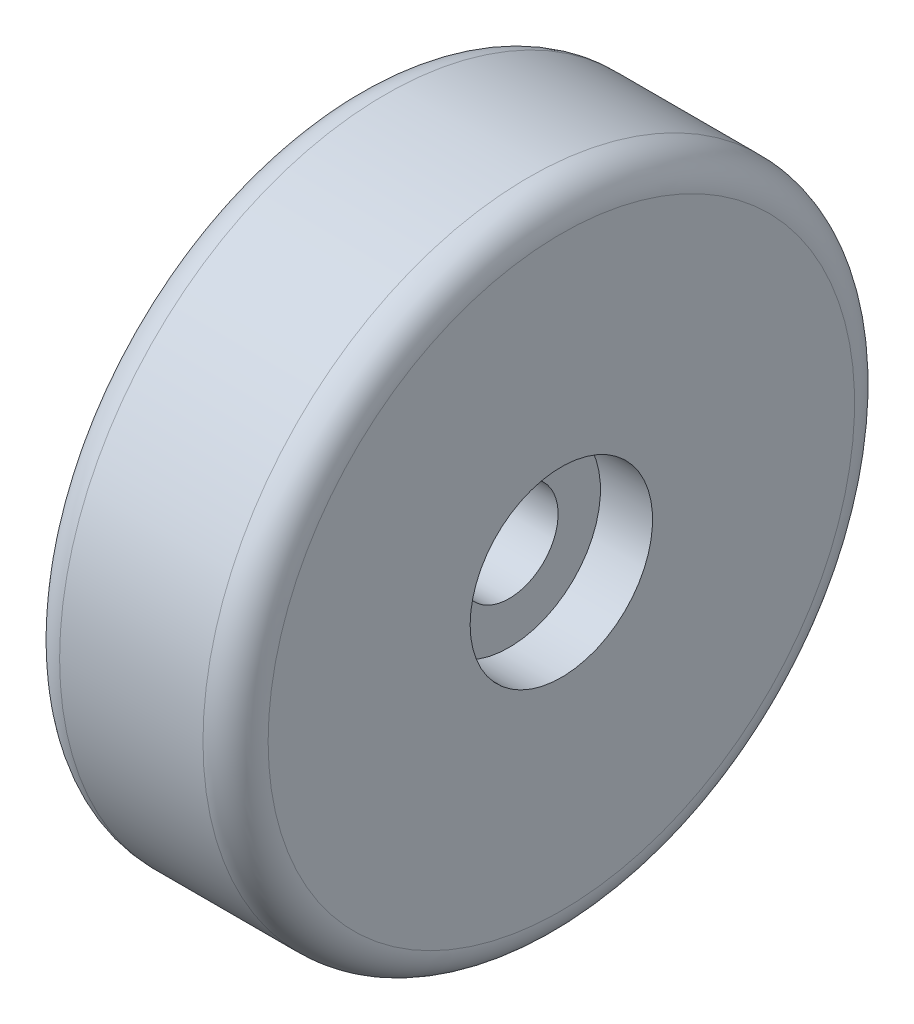
from build123d import *

# Parameters (mm, degrees)
FILLET1_R = 5


with BuildPart() as part:
    # Sketch1 → Revolve1 (revolve)
    with BuildSketch(Plane.XY, mode=Mode.PRIVATE) as revolve1_sk:
        Polygon((8, 7.5), (-8, 7.5), (-8, 14), (-16, 14), (-16, 50), (16, 50), (16, 14), (8, 14), align=None)
    revolve(revolve1_sk.sketch.rotate(Axis((0, 0, 0), (1, 0, 0)), 90), axis=Axis((0, 0, 0), (1, 0, 0)))

    # Fillet1
    fillet1_edges = [part.edges().sort_by_distance(p)[0] for p in [
        (16, 0, -50),
        (-16, 0, -50),
    ]]
    fillet(fillet1_edges, radius=FILLET1_R)


solid = part.part
